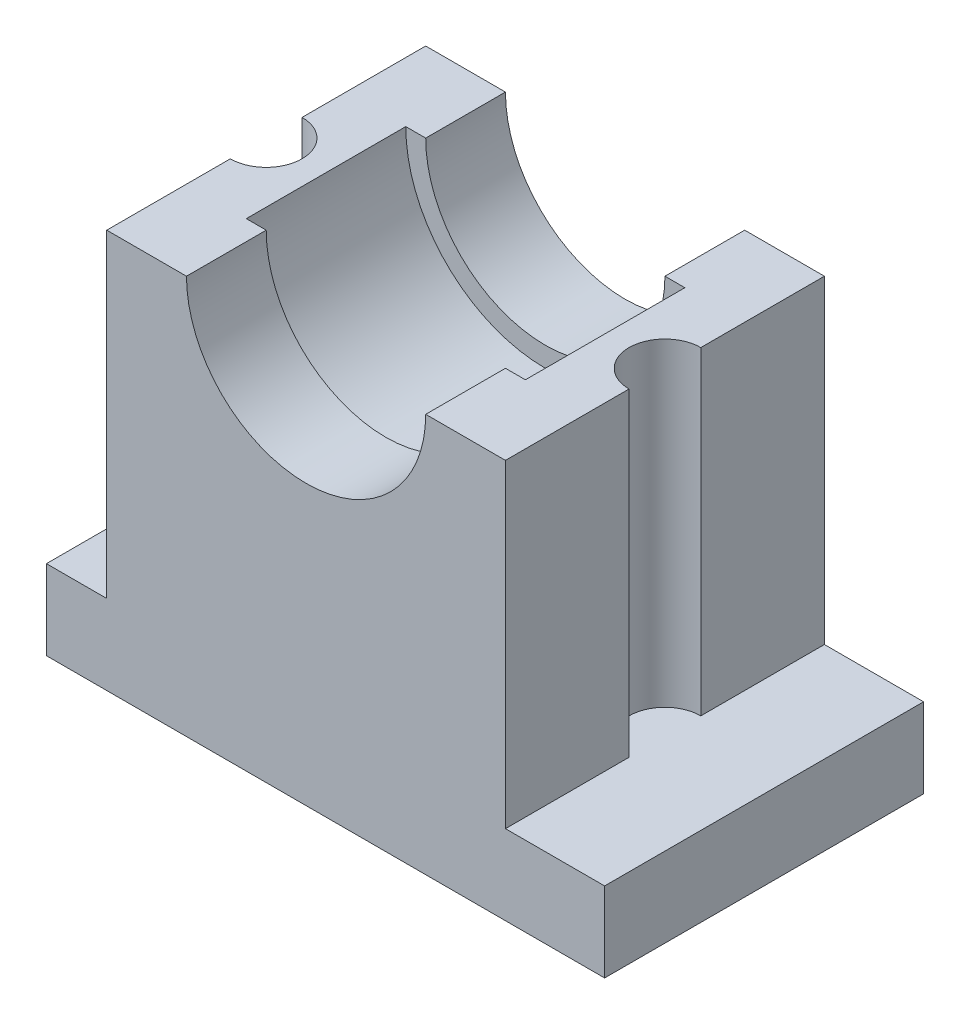
from build123d import *

# Parameters (mm, degrees)
BOSS_EXTRUDE1_DEPTH = 80
SKETCH2_R           = 9
CUT_EXTRUDE1_DEPTH  = 80
SKETCH5_R           = 35
CUT_EXTRUDE2_DEPTH  = 40


with BuildPart() as part:
    # Sketch1 → Boss-Extrude1 (new body)
    with BuildSketch(Plane.XY):
        with BuildLine():
            Line((-99.017681729, 6.463654224), (-99.017681729, -13.536345776))
            Line((-99.017681729, -13.536345776), (40.982318271, -13.536345776))
            Line((40.982318271, -13.536345776), (40.982318271, 6.463654224))
            Line((40.982318271, 6.463654224), (16.110019646, 6.463654224))
            Line((16.110019646, 6.463654224), (16.110019646, 86.463654224))
            Line((16.110019646, 86.463654224), (-3.889980354, 86.463654224))
            ThreePointArc((-3.889980354, 86.463654224), (-33.889980354, 56.463654224), (-63.889980354, 86.463654224))
            Line((-63.889980354, 86.463654224), (-83.889980354, 86.463654224))
            Line((-83.889980354, 86.463654224), (-83.889980354, 6.463654224))
            Line((-83.889980354, 6.463654224), (-99.017681729, 6.463654224))
        make_face()
    extrude(amount=-BOSS_EXTRUDE1_DEPTH)

    # Sketch2 → Cut-Extrude1 (cut)
    with BuildSketch(Plane(origin=(0, 86.463654224, 0), x_dir=(1, 0, 0), z_dir=(0, 1, 0))):
        with Locations((16.110019646, 40)):
            Circle(SKETCH2_R)
        with Locations((-83.889980354, 40)):
            Circle(SKETCH2_R)
    extrude(amount=-CUT_EXTRUDE1_DEPTH, mode=Mode.SUBTRACT)


with BuildPart() as part_1:
    # Body-Move/Copy1: moved
    add(part.part.moved(Location((0, 0, 20))))

    # Sketch5 → Cut-Extrude2 (cut)
    with BuildSketch(Plane.XY):
        with Locations((-33.889980354, 86.463654224)):
            Circle(SKETCH5_R)
    extrude(amount=-CUT_EXTRUDE2_DEPTH, mode=Mode.SUBTRACT)


solid = part_1.part
